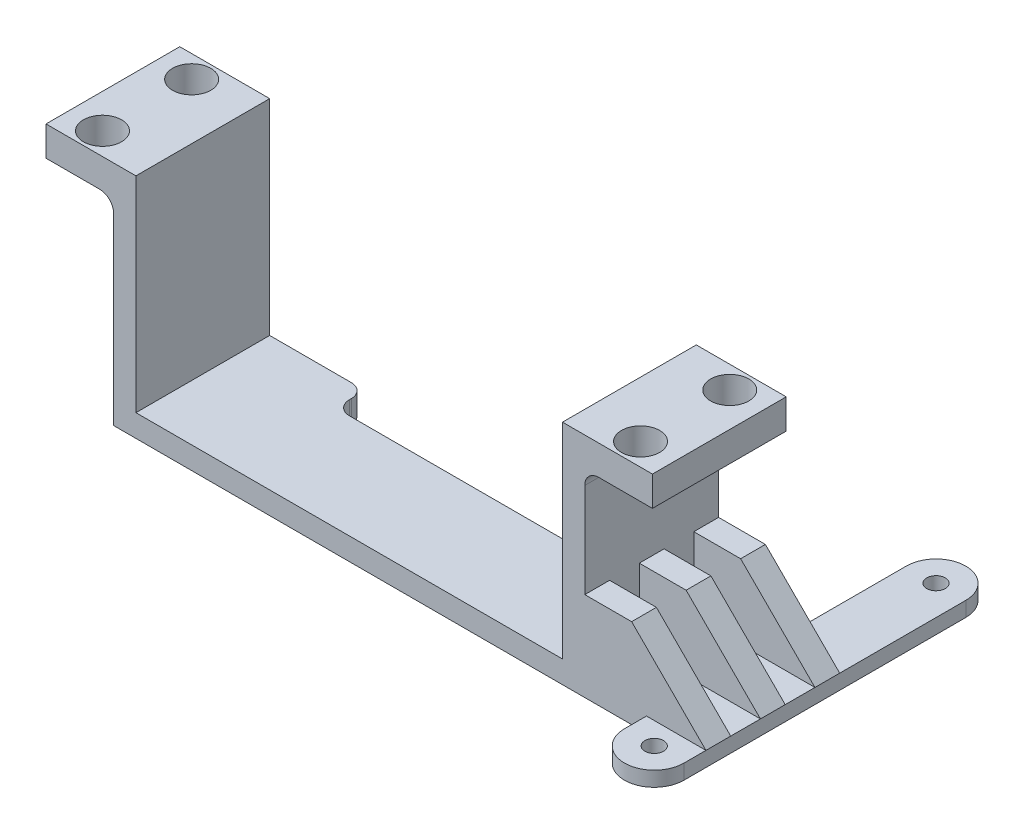
from build123d import *

# Parameters (mm, degrees)
BOSS_EXTRUDE1_DEPTH = 22.86
SKETCH2_R           = 1.5875
BOSS_EXTRUDE2_DEPTH = 2.54
SKETCH4_W           = 15.367
SKETCH4_H           = 22.86
SKETCH4_R           = 3.2639
BOSS_EXTRUDE3_DEPTH = 5.08
SKETCH5_W           = 20.701
SKETCH5_H           = 4.233333333
SKETCH5_H_2         = 4.233333334
BOSS_EXTRUDE4_DEPTH = 12.7
CHAMFER1_SIZE       = 12.7
FILLET1_R           = 2.38
SKETCH6_W           = 50.8
SKETCH6_H           = 5.08
CUT_EXTRUDE1_DEPTH  = 110.560976655
FILLET2_R           = 2.38


with BuildPart() as part:
    # Sketch1 → Boss-Extrude1 (new body)
    with BuildSketch(Plane.XY):
        Polygon((-3.81, 35.052), (0, 35.052), (0, 0), (72.898, 0), (72.898, 35.052), (76.708, 35.052), (76.708, -3.81), (-3.81, -3.81), align=None)
    extrude(amount=BOSS_EXTRUDE1_DEPTH)

    # Sketch2 → Boss-Extrude2 (add)
    with BuildSketch(Plane.XZ.offset(3.81)):
        with BuildLine():
            ThreePointArc((97.409, 26.6192), (92.329, 31.6992), (87.249, 26.6192))
            Line((87.249, 26.6192), (87.249, 22.86))
            Line((87.249, 22.86), (76.708, 22.86))
            Line((76.708, 22.86), (76.708, 0))
            Line((76.708, 0), (87.249, 0))
            Line((87.249, 0), (87.249, -21.5392))
            ThreePointArc((87.249, -21.5392), (92.329, -26.6192), (97.409, -21.5392))
            Line((97.409, -21.5392), (97.409, 26.6192))
        make_face()
        with Locations((92.329, -21.5392)):
            Circle(SKETCH2_R, mode=Mode.SUBTRACT)
        with Locations((92.329, 26.6192)):
            Circle(SKETCH2_R, mode=Mode.SUBTRACT)
    extrude(amount=-BOSS_EXTRUDE2_DEPTH)

    # Sketch4 → Boss-Extrude3 (add)
    with BuildSketch(Plane(origin=(0, 35.052, 0), x_dir=(1, 0, 0), z_dir=(0, 1, 0))):
        with Locations((-7.6835, -11.43)):
            Rectangle(SKETCH4_W, SKETCH4_H)
        with Locations(Location((-9.525, -3.81, 0), (0, 0, 270))):
            Circle(SKETCH4_R, mode=Mode.SUBTRACT)
        with Locations(Location((-9.525, -19.05, 0), (0, 0, 270))):
            Circle(SKETCH4_R, mode=Mode.SUBTRACT)
    boss_extrude3 = extrude(amount=-BOSS_EXTRUDE3_DEPTH)

    # Mirror1: Boss-Extrude3 across plane
    add(boss_extrude3.mirror(Plane(origin=(36.449, 0, 0), x_dir=(0, 0, 1), z_dir=(1, 0, 0))))

    # Sketch5 → Boss-Extrude4 (add)
    with BuildSketch(Plane(origin=(0, -1.27, 0), x_dir=(1, 0, 0), z_dir=(0, 1, 0))):
        with Locations((87.0585, -2.116666667)):
            Rectangle(SKETCH5_W, SKETCH5_H)
        with Locations((87.0585, -20.743333334)):
            Rectangle(SKETCH5_W, SKETCH5_H)
        with Locations((87.0585, -11.43)):
            Rectangle(SKETCH5_W, SKETCH5_H_2)
    extrude(amount=BOSS_EXTRUDE4_DEPTH)

    # Chamfer1
    chamfer1_edges = [part.edges().sort_by_distance(p)[0] for p in [
        (97.409, 11.43, 20.743333333),
        (97.409, 11.43, 11.43),
        (97.409, 11.43, 2.116666667),
    ]]
    chamfer(chamfer1_edges, length=CHAMFER1_SIZE)

    # Fillet1
    fillet1_edges = [part.edges().sort_by_distance(p)[0] for p in [
        (-3.81, 29.972, 11.43),
        (76.708, 29.972, 11.43),
    ]]
    fillet(fillet1_edges, radius=FILLET1_R)

    # Sketch6 → Cut-Extrude1 (cut, through all)
    with BuildSketch(Plane.XZ.offset(3.81)):
        with Locations((41.7195, 2.54)):
            Rectangle(SKETCH6_W, SKETCH6_H)
    extrude(amount=-CUT_EXTRUDE1_DEPTH, mode=Mode.SUBTRACT)

    # Fillet2
    fillet2_edges = [part.edges().sort_by_distance(p)[0] for p in [
        (16.3195, -1.905, 0),
        (67.1195, -1.905, 0),
        (16.3195, -1.905, 5.08),
        (67.1195, -1.905, 5.08),
    ]]
    fillet(fillet2_edges, radius=FILLET2_R)


solid = part.part
